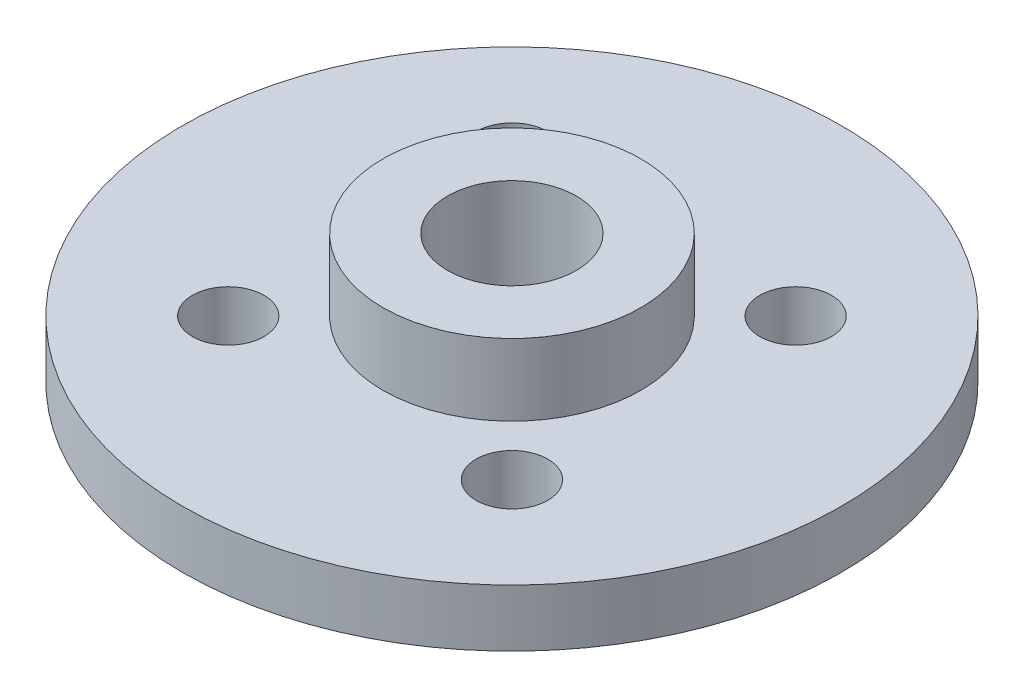
from build123d import *

# Parameters (mm, degrees)
SKETCH1_R           = 11.5
SKETCH1_R_2         = 1.25
SKETCH1_R_3         = 1.5
BOSS_EXTRUDE1_DEPTH = 2
SKETCH2_R           = 4.5
SKETCH2_R_2         = 1.5
BOSS_EXTRUDE2_DEPTH = 2.5
SKETCH3_R           = 2.25
CUT_EXTRUDE1_DEPTH  = 3.6


with BuildPart() as part:
    # Sketch1 → Boss-Extrude1 (new body)
    with BuildSketch(Plane(origin=(0, 0, 0), x_dir=(1, 0, 0), z_dir=(0, 1, 0))):
        with Locations(Location((0, 0, 0), (0, 0, 270))):
            Circle(SKETCH1_R)
        with Locations(Location((-4.949747468, 4.949747468, 0), (0, 0, 270))):
            Circle(SKETCH1_R_2, mode=Mode.SUBTRACT)
        with Locations(Location((4.949747468, 4.949747468, 0), (0, 0, 270))):
            Circle(SKETCH1_R_2, mode=Mode.SUBTRACT)
        with Locations(Location((4.949747468, -4.949747468, 0), (0, 0, 270))):
            Circle(SKETCH1_R_2, mode=Mode.SUBTRACT)
        with Locations(Location((-4.949747468, -4.949747468, 0), (0, 0, 270))):
            Circle(SKETCH1_R_2, mode=Mode.SUBTRACT)
        with Locations(Location((0, 0, 0), (0, 0, 270))):
            Circle(SKETCH1_R_3, mode=Mode.SUBTRACT)
    extrude(amount=BOSS_EXTRUDE1_DEPTH)

    # Sketch2 → Boss-Extrude2 (add)
    with BuildSketch(Plane(origin=(0, 2, 0), x_dir=(1, 0, 0), z_dir=(0, 1, 0))):
        with Locations(Location((0, 0, 0), (0, 0, 270))):
            Circle(SKETCH2_R)
        with Locations(Location((0, 0, 0), (0, 0, 270))):
            Circle(SKETCH2_R_2, mode=Mode.SUBTRACT)
    extrude(amount=BOSS_EXTRUDE2_DEPTH)

    # Sketch3 → Cut-Extrude1 (cut)
    with BuildSketch(Plane(origin=(0, 4.5, 0), x_dir=(1, 0, 0), z_dir=(0, 1, 0))):
        with Locations(Location((0, 0, 0), (0, 0, 270))):
            Circle(SKETCH3_R)
    extrude(amount=-CUT_EXTRUDE1_DEPTH, mode=Mode.SUBTRACT)


solid = part.part
